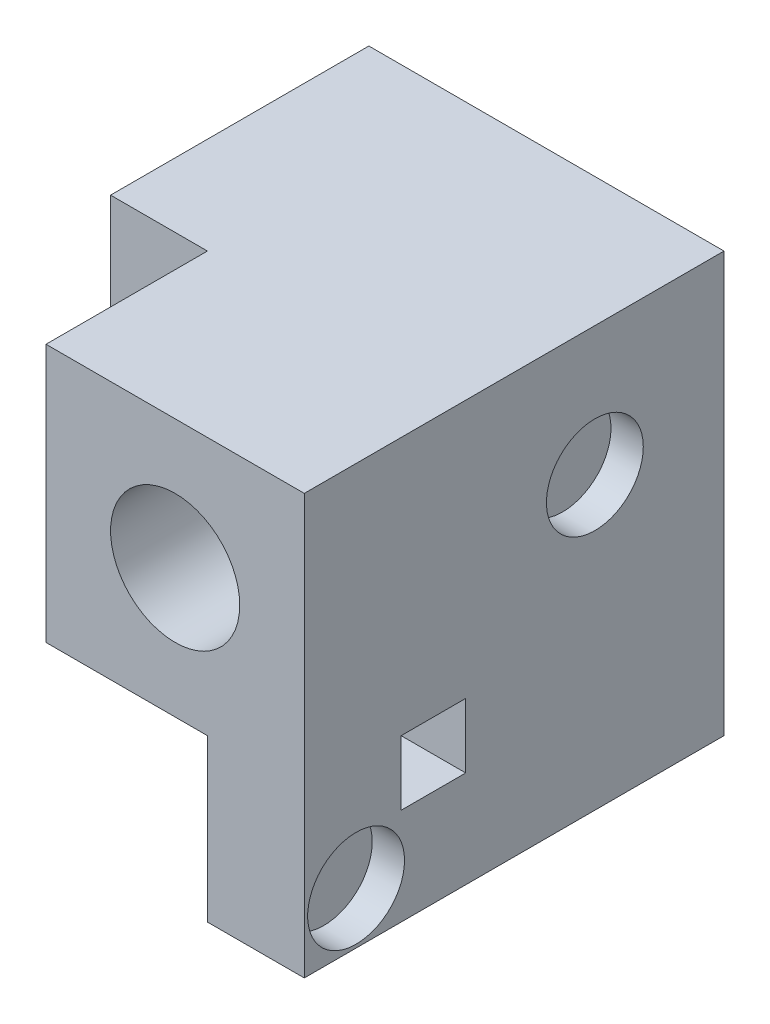
from build123d import *

# Parameters (mm, degrees)
ESQUISSE2_W             = 80
ESQUISSE2_H             = 80
BOSS_EXTRU_1_DEPTH      = 80
ESQUISSE5_W             = 80
ESQUISSE5_H             = 80
BOSS_EXTRU_2_DEPTH      = 30
ESQUISSE6_W             = 80
ESQUISSE6_H             = 80
BOSS_EXTRU_3_DEPTH      = 50
ESQUISSE7_W             = 80
ESQUISSE7_H             = 80
BOSS_EXTRU_4_DEPTH      = 50
ESQUISSE8_R             = 20
ENL_V_MAT_EXTRU_1_DEPTH = 45
ESQUISSE9_R             = 20
ENL_V_MAT_EXTRU_2_DEPTH = 65
ESQUISSE10_R            = 20
ENL_V_MAT_EXTRU_3_DEPTH = 65
ESQUISSE16_W            = 30
ESQUISSE16_H            = 30
BOSS_EXTRU_9_DEPTH      = 50
ESQUISSE17_W            = 30
ESQUISSE17_H            = 30
BOSS_EXTRU_10_DEPTH     = 50
ESQUISSE19_R            = 15
ENL_V_MAT_EXTRU_4_DEPTH = 10


with BuildPart() as part:
    # Esquisse2 → Boss.-Extru.1 (new body)
    with BuildSketch(Plane(origin=(0, 0, 0), x_dir=(1, 0, 0), z_dir=(0, 1, 0))):
        Rectangle(ESQUISSE2_W, ESQUISSE2_H)
    extrude(amount=BOSS_EXTRU_1_DEPTH)

    # Esquisse5 → Boss.-Extru.2 (add)
    with BuildSketch(Plane.ZY.offset(40)):
        with Locations((0, 40)):
            Rectangle(ESQUISSE5_W, ESQUISSE5_H)
    extrude(amount=BOSS_EXTRU_2_DEPTH)

    # Esquisse6 → Boss.-Extru.3 (add)
    with BuildSketch(Plane.XY.offset(40)):
        with Locations((0, 40)):
            Rectangle(ESQUISSE6_W, ESQUISSE6_H)
    extrude(amount=BOSS_EXTRU_3_DEPTH)

    # Esquisse7 → Boss.-Extru.4 (add)
    with BuildSketch(Plane.XZ):
        Rectangle(ESQUISSE7_W, ESQUISSE7_H)
    extrude(amount=BOSS_EXTRU_4_DEPTH)

    # Esquisse8 → Enlèv. mat.-Extru.1 (cut)
    with BuildSketch(Plane.ZY.offset(70)):
        with Locations((0, 40)):
            Circle(ESQUISSE8_R)
    extrude(amount=-ENL_V_MAT_EXTRU_1_DEPTH, mode=Mode.SUBTRACT)

    # Esquisse9 → Enlèv. mat.-Extru.2 (cut)
    with BuildSketch(Plane.XY.offset(90)):
        with Locations((0, 40)):
            Circle(ESQUISSE9_R)
    extrude(amount=-ENL_V_MAT_EXTRU_2_DEPTH, mode=Mode.SUBTRACT)

    # Esquisse10 → Enlèv. mat.-Extru.3 (cut)
    with BuildSketch(Plane.XZ.offset(50)):
        with Locations(Location((0, 0, 0), (0, 0, 270))):
            Circle(ESQUISSE10_R)
    extrude(amount=-ENL_V_MAT_EXTRU_3_DEPTH, mode=Mode.SUBTRACT)

    # Esquisse16 → Boss.-Extru.9 (add)
    with BuildSketch(Plane.XZ):
        with Locations((25, 75)):
            Rectangle(ESQUISSE16_W, ESQUISSE16_H)
    extrude(amount=BOSS_EXTRU_9_DEPTH)

    # Esquisse17 → Boss.-Extru.10 (add)
    with BuildSketch(Plane.XY.offset(40)):
        with Locations((25, -35)):
            Rectangle(ESQUISSE17_W, ESQUISSE17_H)
    extrude(amount=BOSS_EXTRU_10_DEPTH)

    # Esquisse19 → Enlèv. mat.-Extru.4 (cut)
    with BuildSketch(Plane(origin=(40, 0, 0), x_dir=(0, 0, -1), z_dir=(1, 0, 0))):
        with Locations((-73.956364881, -33.956364881)):
            Circle(ESQUISSE19_R)
        with Locations((0, 40)):
            Circle(ESQUISSE19_R)
    extrude(amount=-ENL_V_MAT_EXTRU_4_DEPTH, mode=Mode.SUBTRACT)


solid = part.part
